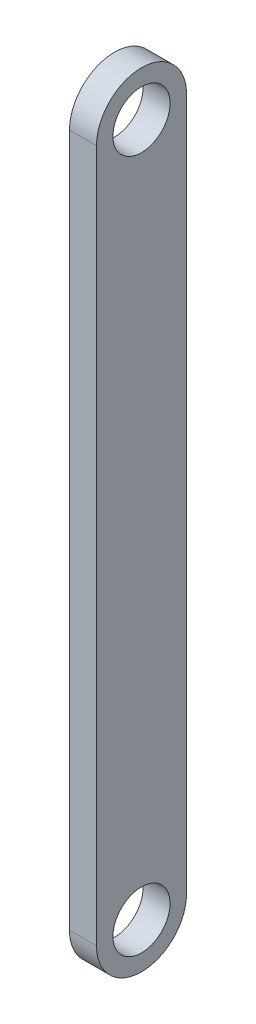
from build123d import *

# Parameters (mm, degrees)
SKETCH3_W           = 10
SKETCH3_H           = 87
BOSS_EXTRUDE1_DEPTH = 3
SKETCH4_R           = 3.175
CUT_EXTRUDE1_DEPTH  = 5
FILLET1_RADIUS      = 5
FILLET1_LENGTH      = 3
FILLET2_RADIUS      = 5
FILLET2_LENGTH      = 3


with BuildPart() as part:
    # Sketch3 → Boss-Extrude1 (new body)
    with BuildSketch(Plane(origin=(0, 0, 0), x_dir=(0, 0, -1), z_dir=(1, 0, 0))):
        Rectangle(SKETCH3_W, SKETCH3_H)
    extrude(amount=BOSS_EXTRUDE1_DEPTH)

    # Sketch4 → Cut-Extrude1 (cut)
    with BuildSketch(Plane(origin=(3, 0, 0), x_dir=(0, 0, -1), z_dir=(1, 0, 0))):
        with Locations((0, 38.5)):
            Circle(SKETCH4_R)
        with Locations((0, -38.5)):
            Circle(SKETCH4_R)
    extrude(amount=-CUT_EXTRUDE1_DEPTH, mode=Mode.SUBTRACT)

    # Fillet1: full round fillet: the end face becomes a half cylinder, R = half its width
    fillet1_face = Plane((1.5, 43.5, 0), x_dir=(-1, 0, 0), z_dir=(0, 1, 0))  # on the end face: x along it, z out of the body
    fillet1_slab = fillet1_face.offset(-FILLET1_RADIUS / 2) * Box(FILLET1_LENGTH, 2 * FILLET1_RADIUS, FILLET1_RADIUS, mode=Mode.PRIVATE)  # the body's end, R deep
    fillet1_round = Plane((1.5, 38.5, 0), x_dir=(0, 1, 0), z_dir=(-1, 0, 0)) * Cylinder(FILLET1_RADIUS, FILLET1_LENGTH, mode=Mode.PRIVATE)  # its axis R under the face
    add(fillet1_slab - fillet1_round, mode=Mode.SUBTRACT)

    # Fillet2: full round fillet: the end face becomes a half cylinder, R = half its width
    fillet2_face = Plane((1.5, -43.5, 0), x_dir=(-1, 0, 0), z_dir=(0, -1, 0))  # on the end face: x along it, z out of the body
    fillet2_slab = fillet2_face.offset(-FILLET2_RADIUS / 2) * Box(FILLET2_LENGTH, 2 * FILLET2_RADIUS, FILLET2_RADIUS, mode=Mode.PRIVATE)  # the body's end, R deep
    fillet2_round = Plane((1.5, -38.5, 0), x_dir=(0, -1, 0), z_dir=(-1, 0, 0)) * Cylinder(FILLET2_RADIUS, FILLET2_LENGTH, mode=Mode.PRIVATE)  # its axis R under the face
    add(fillet2_slab - fillet2_round, mode=Mode.SUBTRACT)


solid = part.part
